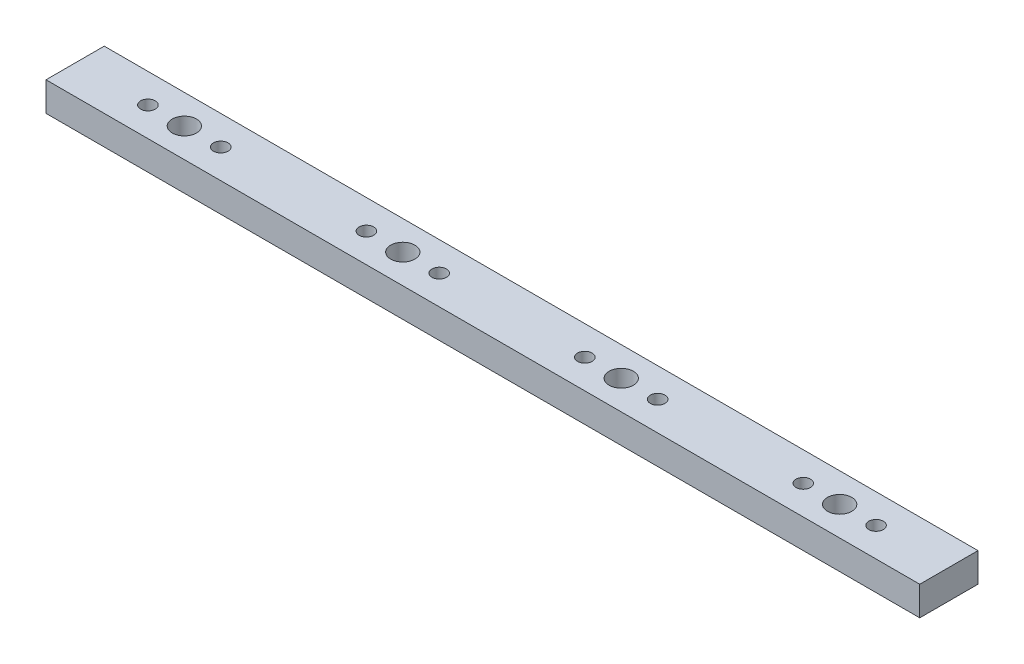
from build123d import *

# Parameters (mm, degrees)
SKETCH1_W           = 360
SKETCH1_H           = 24
BOSS_EXTRUDE1_DEPTH = 12
CUT_EXTRUDE1_REACH  = 182.798
SKETCH2_R           = 3
SKETCH2_R_2         = 5
LPATTERN1_COUNT     = 4
LPATTERN1_PITCH     = 90


with BuildPart() as part:
    # Sketch1 → Boss-Extrude1 (new body)
    with BuildSketch(Plane(origin=(0, 0, 0), x_dir=(1, 0, 0), z_dir=(0, 1, 0))):
        Rectangle(SKETCH1_W, SKETCH1_H)
    extrude(amount=BOSS_EXTRUDE1_DEPTH)

    # Sketch2 → Cut-Extrude1 (cut, up to next)
    with BuildSketch(Plane(origin=(0, 12, 0), x_dir=(1, 0, 0), z_dir=(0, 1, 0)), mode=Mode.PRIVATE) as cut_extrude1_sk1:
        with Locations(Location((-150, 0, 0), (0, 0, 270))):
            Circle(SKETCH2_R)
    cut_extrude1_tool1 = extrude(cut_extrude1_sk1.sketch, amount=-CUT_EXTRUDE1_REACH, mode=Mode.PRIVATE) & part.part
    # Sketch2 → Cut-Extrude1 (cut, up to next)
    with BuildSketch(Plane(origin=(0, 12, 0), x_dir=(1, 0, 0), z_dir=(0, 1, 0)), mode=Mode.PRIVATE) as cut_extrude1_sk2:
        with Locations(Location((-120, 0, 0), (0, 0, 270))):
            Circle(SKETCH2_R)
    cut_extrude1_tool2 = extrude(cut_extrude1_sk2.sketch, amount=-CUT_EXTRUDE1_REACH, mode=Mode.PRIVATE) & part.part
    # Sketch2 → Cut-Extrude1 (cut, up to next)
    with BuildSketch(Plane(origin=(0, 12, 0), x_dir=(1, 0, 0), z_dir=(0, 1, 0)), mode=Mode.PRIVATE) as cut_extrude1_sk3:
        with Locations(Location((-135, 0, 0), (0, 0, 270))):
            Circle(SKETCH2_R_2)
    cut_extrude1_tool3 = extrude(cut_extrude1_sk3.sketch, amount=-CUT_EXTRUDE1_REACH, mode=Mode.PRIVATE) & part.part
    cut_extrude1_1 = cut_extrude1_tool1.solids().sort_by_distance((-150, 12, 0))[0]
    add(cut_extrude1_1, mode=Mode.SUBTRACT)
    cut_extrude1_2 = cut_extrude1_tool2.solids().sort_by_distance((-120, 12, 0))[0]
    add(cut_extrude1_2, mode=Mode.SUBTRACT)
    cut_extrude1_3 = cut_extrude1_tool3.solids().sort_by_distance((-135, 12, 0))[0]
    add(cut_extrude1_3, mode=Mode.SUBTRACT)
    cut_extrude1 = cut_extrude1_1 + cut_extrude1_2 + cut_extrude1_3  # Cut-Extrude1 as one shape, for the pattern or mirror that repeats it

    # LPattern1: Cut-Extrude1 ×4
    with Locations(*[(i * LPATTERN1_PITCH, 0, 0) for i in range(1, LPATTERN1_COUNT)]):
        add(cut_extrude1, mode=Mode.SUBTRACT)


solid = part.part
